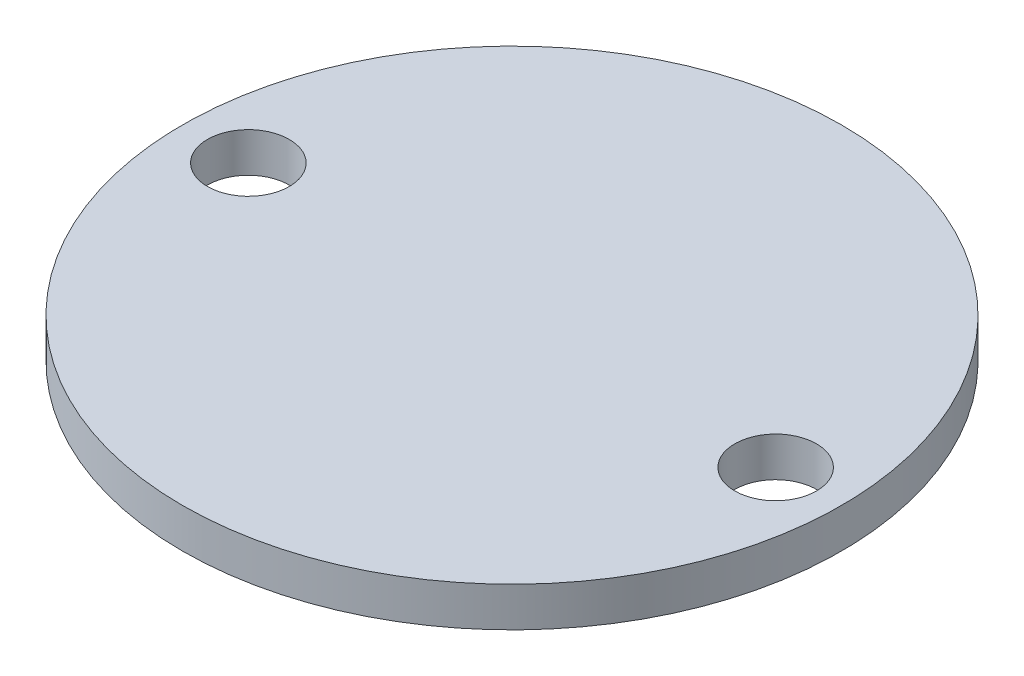
from build123d import *

# Parameters (mm, degrees)
SKETCH_1_R          = 12.5
EXTRUDE_1_DEPTH     = 1.5
SKETCH_2_R          = 1.55
CUT_EXTRUDE_1_DEPTH = 18.741194999


with BuildPart() as part:
    # Эскиз1 → Бобышка-Вытянуть1 (new body)
    with BuildSketch(Plane(origin=(0, 0, 0), x_dir=(1, 0, 0), z_dir=(0, 1, 0))):
        with Locations(Location((0, 0, 0), (0, 0, 270))):
            Circle(SKETCH_1_R)
    extrude(amount=EXTRUDE_1_DEPTH)

    # Эскиз2 → Вырез-Вытянуть1 (cut, through all)
    with BuildSketch(Plane(origin=(0, 1.5, 0), x_dir=(1, 0, 0), z_dir=(0, 1, 0))):
        with Locations(Location((10, 0, 0), (0, 0, 270))):
            Circle(SKETCH_2_R)
        with Locations(Location((-10, 0, 0), (0, 0, 270))):
            Circle(SKETCH_2_R)
    extrude(amount=-CUT_EXTRUDE_1_DEPTH, mode=Mode.SUBTRACT)


solid = part.part
